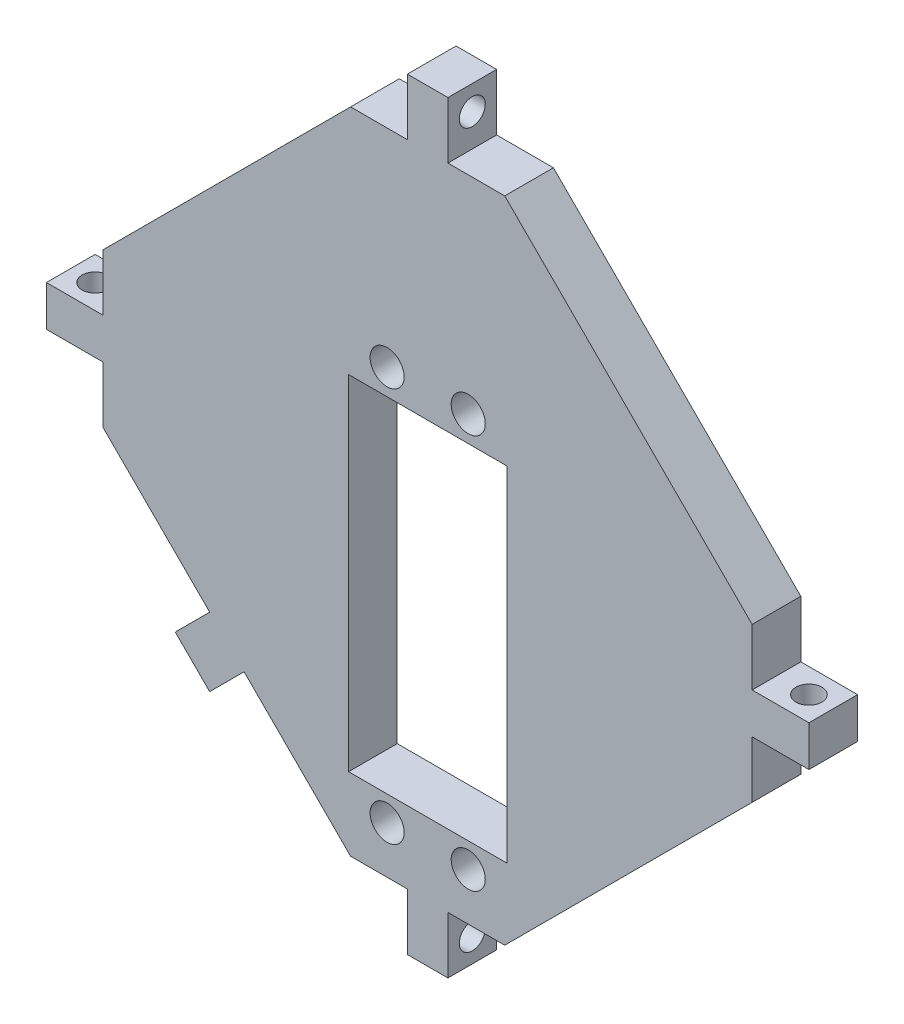
from build123d import *

# Parameters (mm, degrees)
SKETCH_1_R          = 2.1
SKETCH_1_W          = 5
SKETCH_1_H          = 7
SKETCH_1_W_2        = 7
SKETCH_1_H_2        = 5
SKETCH_1_W_3        = 19.5
SKETCH_1_H_3        = 6.75
EXTRUDE_2_DEPTH     = 6
SKETCH_2_R          = 1.6
CUT_EXTRUDE_1_DEPTH = 5
SKETCH_3_R          = 1.6
CUT_EXTRUDE_2_DEPTH = 5
SKETCH_4_R          = 1.6
CUT_EXTRUDE_3_DEPTH = 5
SKETCH_5_R          = 1.6
CUT_EXTRUDE_4_DEPTH = 5
EXTRUDE_3_DEPTH     = 6
SKETCH_7_R          = 1.6
CUT_EXTRUDE_5_DEPTH = 10
SKETCH_8_W          = 19.5
SKETCH_8_H          = 40.4
SKETCH_8_H_2        = 1
CUT_EXTRUDE_6_DEPTH = 10


with BuildPart() as part:
    # 草图1 → 凸台-拉伸2 (new body)
    # profile 1 of 6: a face of its own
    with BuildSketch(Plane.XY):
        Polygon((-9.5, 39.997474683), (-39.997474683, 9.5), (-39.997474683, 2.5), (-39.997474683, -2.5), (-39.997474683, -9.5), (-9.5, -39.997474683), (-2.5, -39.997474683), (2.5, -39.997474683), (9.5, -39.997474683), (39.997474683, -9.5), (39.997474683, -2.5), (39.997474683, 2.5), (39.997474683, 9.5), (9.5, 39.997474683), (2.5, 39.997474683), (-2.5, 39.997474683), align=None)
        Polygon((-9.75, -30.1), (-9.75, 10.3), (9.75, 10.3), (9.75, -30.1), (9.75, -36.85), (-9.75, -36.85), align=None, mode=Mode.SUBTRACT)
        with Locations((-5, 14.465)):
            Circle(SKETCH_1_R, mode=Mode.SUBTRACT)
        with Locations((5, 14.465)):
            Circle(SKETCH_1_R, mode=Mode.SUBTRACT)
    # profile 2 of 6: a face of its own
    with BuildSketch(Plane.XY):
        with Locations((0, 43.497474683)):
            Rectangle(SKETCH_1_W, SKETCH_1_H)
    # profile 3 of 6: a face of its own
    with BuildSketch(Plane.XY):
        with Locations((-43.497474683, 0)):
            Rectangle(SKETCH_1_W_2, SKETCH_1_H_2)
    # profile 4 of 6: a face of its own
    with BuildSketch(Plane.XY):
        with Locations((0, -43.497474683)):
            Rectangle(SKETCH_1_W, SKETCH_1_H)
    # profile 5 of 6: a face of its own
    with BuildSketch(Plane.XY):
        with Locations((43.497474683, 0)):
            Rectangle(SKETCH_1_W_2, SKETCH_1_H_2)
    # profile 6 of 6: a face of its own
    with BuildSketch(Plane.XY):
        with Locations((0, -33.475)):
            Rectangle(SKETCH_1_W_3, SKETCH_1_H_3)
        with Locations((5, -34.165)):
            Circle(SKETCH_1_R, mode=Mode.SUBTRACT)
        with Locations((-5, -34.165)):
            Circle(SKETCH_1_R, mode=Mode.SUBTRACT)
    extrude(amount=EXTRUDE_2_DEPTH)

    # 草图2 → 切除-拉伸1 (cut)
    with BuildSketch(Plane.XZ.offset(2.5)):
        with Locations((-43.997474683, 3)):
            Circle(SKETCH_2_R)
    extrude(amount=-CUT_EXTRUDE_1_DEPTH, mode=Mode.SUBTRACT)

    # 草图3 → 切除-拉伸2 (cut)
    with BuildSketch(Plane(origin=(2.5, 0, 0), x_dir=(0, 0, -1), z_dir=(1, 0, 0))):
        with Locations(Location((-3, -43.997474683, 0), (0, 0, 90))):
            Circle(SKETCH_3_R)
    extrude(amount=-CUT_EXTRUDE_2_DEPTH, mode=Mode.SUBTRACT)

    # 草图4 → 切除-拉伸3 (cut)
    with BuildSketch(Plane(origin=(0, 2.5, 0), x_dir=(1, 0, 0), z_dir=(0, 1, 0))):
        with Locations(Location((43.997474683, -3, 0), (0, 0, 180))):
            Circle(SKETCH_4_R)
    extrude(amount=-CUT_EXTRUDE_3_DEPTH, mode=Mode.SUBTRACT)

    # 草图5 → 切除-拉伸4 (cut)
    with BuildSketch(Plane.ZY.offset(2.5)):
        with Locations(Location((3, 43.997474683, 0), (0, 0, 270))):
            Circle(SKETCH_5_R)
    extrude(amount=-CUT_EXTRUDE_4_DEPTH, mode=Mode.SUBTRACT)

    # 草图6 → 凸台-拉伸3 (add)
    with BuildSketch(Plane.XY.offset(6)):
        Polygon((-26.870057685, -31.112698372), (-22.627416998, -26.870057685), (-26.870057685, -22.627416998), (-31.112698372, -26.870057685), align=None)
    extrude(amount=-EXTRUDE_3_DEPTH)

    # 草图7 → 切除-拉伸5 (cut)
    with BuildSketch(Plane(origin=(-2.121320344, 2.121320344, 0), x_dir=(0, 0, 1), z_dir=(-0.7071067811865485, 0.7071067811865466, 0))):
        with Locations(Location((3, -38, 0), (0, 0, 270))):
            Circle(SKETCH_7_R)
    extrude(amount=-CUT_EXTRUDE_5_DEPTH, mode=Mode.SUBTRACT)

    # 草图8 → 切除-拉伸6 (cut)
    with BuildSketch(Plane(origin=(0, 0, 0), x_dir=(-1, 0, 0), z_dir=(0, 0, -1))):
        with Locations((0, -9.9)):
            Rectangle(SKETCH_8_W, SKETCH_8_H)
        with Locations((0, 10.8)):
            Rectangle(SKETCH_8_W, SKETCH_8_H_2)
        with Locations((0, -30.6)):
            Rectangle(SKETCH_8_W, SKETCH_8_H_2)
    extrude(amount=-CUT_EXTRUDE_6_DEPTH, mode=Mode.SUBTRACT)


solid = part.part
